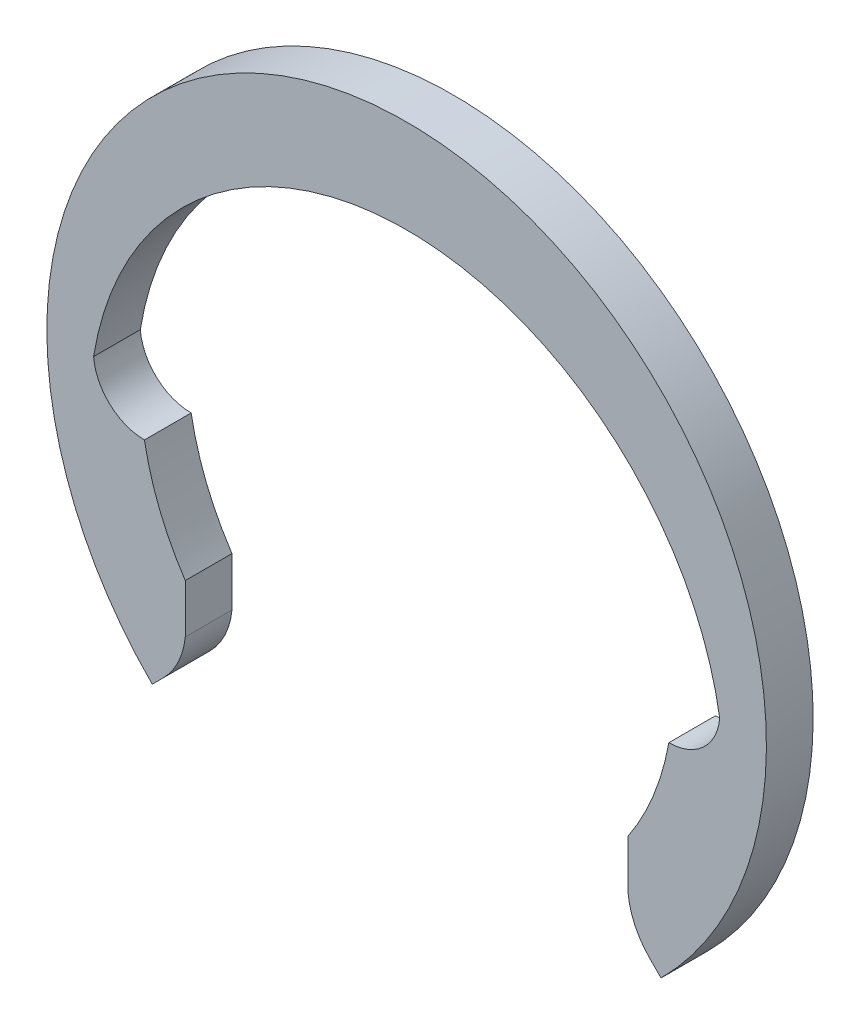
from build123d import *

# Parameters (mm, degrees)
BOSS_EXTRUDE1_DEPTH = 1


with BuildPart() as part:
    # Sketch2 → Boss-Extrude1 (new body)
    with BuildSketch(Plane.XY):
        with BuildLine():
            Line((-4.737615434, -4.214871889), (-4.737615434, -3.692128344))
            Line((-4.737615434, -3.692128344), (-4.737615434, -3.169384798))
            ThreePointArc((-4.737615434, -3.169384798), (-5.287068892, -2.130000594), (-5.611595139, -1))
            ThreePointArc((-5.611595139, -1), (-6.350619012, -0.712044605), (-6.7, 0))
            ThreePointArc((-6.7, 0), (0, 5.7), (6.7, 0))
            ThreePointArc((6.7, 0), (6.350619012, -0.712044605), (5.611595139, -1))
            ThreePointArc((5.611595139, -1), (5.287068892, -2.130000594), (4.737615434, -3.169384798))
            Line((4.737615434, -3.169384798), (4.737615434, -3.692128344))
            Line((4.737615434, -3.692128344), (4.737615434, -4.214871889))
            ThreePointArc((4.737615434, -4.214871889), (4.887321146, -4.752723712), (5.209019955, -5.209019955))
            Line((5.209019955, -5.209019955), (5.444722215, -5.444722215))
            ThreePointArc((5.444722215, -5.444722215), (0, 7.7), (-5.444722215, -5.444722215))
            Line((-5.444722215, -5.444722215), (-5.209019955, -5.209019955))
            ThreePointArc((-5.209019955, -5.209019955), (-4.887321146, -4.752723712), (-4.737615434, -4.214871889))
        make_face()
    extrude(amount=BOSS_EXTRUDE1_DEPTH)


solid = part.part
